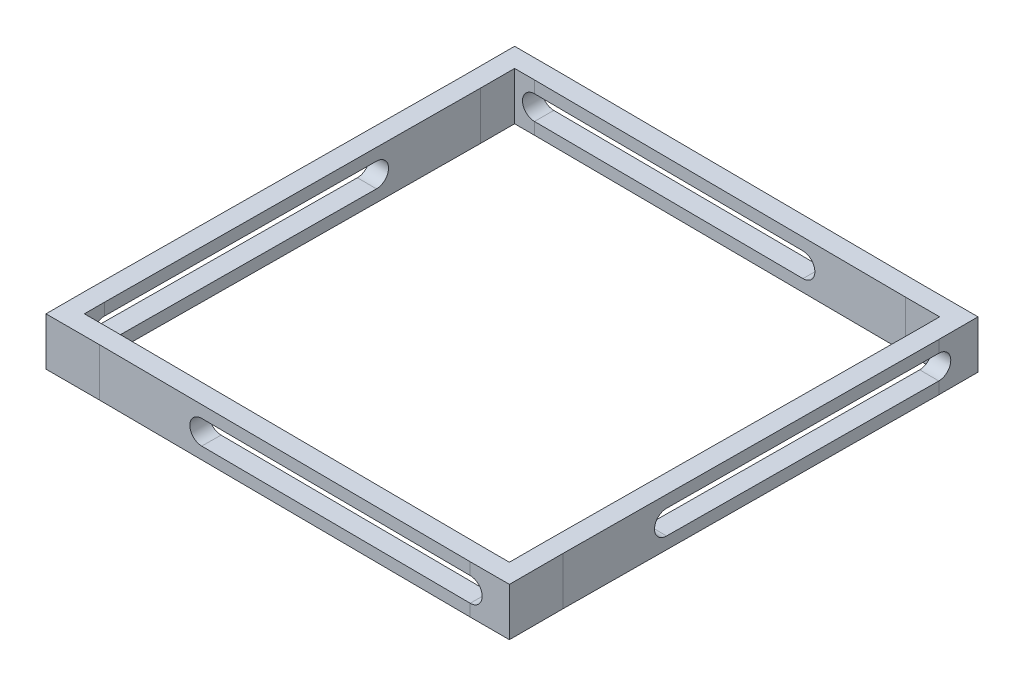
from build123d import *

# Parameters (mm, degrees)
BOSS_EXTRUDE1_DEPTH = 10
SKETCH2_R           = 2.5
CUT_EXTRUDE1_DEPTH  = 10
CIRPATTERN2_COUNT   = 4
CUT_EXTRUDE2_START  = 1
CUT_EXTRUDE2_DEPTH  = 6
CIRPATTERN3_COUNT   = 4


with BuildPart() as part:
    # Sketch1 → Boss-Extrude1 (new body)
    with BuildSketch(Plane(origin=(0, 0, 0), x_dir=(1, 0, 0), z_dir=(0, 1, 0))):
        Polygon((-48.197888799, 37.109268565), (-48.738098109, -40.767831949), (-48.738098109, -48.945710496), (-37.607816364, -48.945710496), (40.26928415, -49.485919806), (48.447162698, -49.485919806), (48.447162698, -38.355638061), (48.987372008, 39.521462453), (48.987372008, 47.699341001), (37.857090263, 47.699341001), (-40.020010251, 48.239550311), (-48.197888799, 48.239550311), align=None)
        Polygon((-40.033883465, 44.239550311), (-44.197888799, 44.239550311), (-44.197888799, 37.095395352), (-44.738098109, -40.781705162), (-44.738098109, -44.945710496), (-37.59394315, -44.945710496), (40.283157364, -45.485919806), (44.447162698, -45.485919806), (44.447162698, -38.341764848), (44.987372008, 39.535335666), (44.987372008, 43.699341001), (37.843217049, 43.699341001), align=None, mode=Mode.SUBTRACT)
    extrude(amount=BOSS_EXTRUDE1_DEPTH)

    # Sketch2 → Cut-Extrude1 (cut)
    with BuildSketch(Plane(origin=(0.332681132, 0, -47.959636197), x_dir=(-0.999975942033621, 0, -0.006936523190502626), z_dir=(0.006936523190502627, 0, -0.9999759420336211))):
        with Locations(Location((40.353662211, 5, 0), (0, 0, 270))):
            Circle(SKETCH2_R)
    cut_extrude1 = extrude(amount=-CUT_EXTRUDE1_DEPTH, mode=Mode.SUBTRACT)

    # CirPattern2: Cut-Extrude1 ×4 about axis
    cirpattern2_axis = Axis((0.12463695, 10, 0.623184748), (0, -1, 0))
    for i in range(1, CIRPATTERN2_COUNT):
        add(cut_extrude1.rotate(cirpattern2_axis, i * 360 / CIRPATTERN2_COUNT), mode=Mode.SUBTRACT)

    # Sketch6 → Cut-Extrude2 (cut)
    with BuildSketch(Plane(origin=(-0.341314401, 0, 49.20421667), x_dir=(0.999975942033621, 0, 0.006936523190502982), z_dir=(-0.006936523190502983, 0, 0.9999759420336211)).offset(CUT_EXTRUDE2_START)):
        with BuildLine():
            Line((40.611575584, 7.5), (-15.76739854, 7.5))
            ThreePointArc((-15.76739854, 7.5), (-18.26739854, 5), (-15.76739854, 2.5))
            Line((-15.76739854, 2.5), (40.611575584, 2.5))
            ThreePointArc((40.611575584, 2.5), (43.111575584, 5), (40.611575584, 7.5))
        make_face()
    cut_extrude2 = extrude(amount=-CUT_EXTRUDE2_DEPTH, mode=Mode.SUBTRACT)

    # CirPattern3: Cut-Extrude2 ×4 about axis
    cirpattern3_axis = Axis((0.12463695, 10, 0.623184748), (0, -1, 0))
    for i in range(1, CIRPATTERN3_COUNT):
        add(cut_extrude2.rotate(cirpattern3_axis, i * 360 / CIRPATTERN3_COUNT), mode=Mode.SUBTRACT)


solid = part.part
